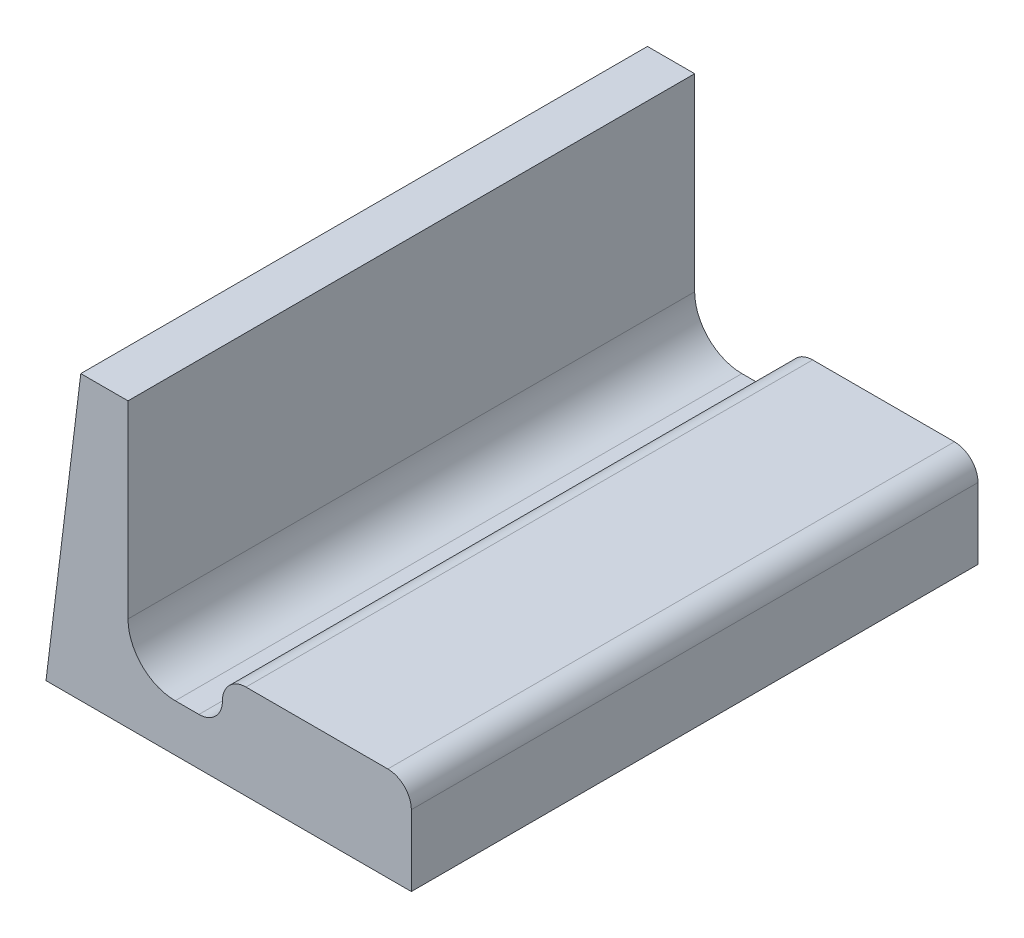
from build123d import *

# Parameters (mm, degrees)
BOSS_EXTRUDE1_DEPTH = 152.4


with BuildPart() as part:
    # Sketch1 → Boss-Extrude1 (new body)
    with BuildSketch(Plane.XY):
        with BuildLine():
            Line((0, 0), (98.256183541, 0))
            Line((98.256183541, 0), (98.256183541, 12.7))
            Line((98.256183541, 12.7), (98.256183541, 19.0754))
            ThreePointArc((98.256183541, 19.0754), (96.403751089, 23.547567548), (91.931583541, 25.4))
            Line((91.931583541, 25.4), (53.780783541, 25.4))
            ThreePointArc((53.780783541, 25.4), (49.308615993, 23.547567548), (47.456183541, 19.0754))
            Line((47.456183541, 19.0754), (47.456183541, 19.0246))
            ThreePointArc((47.456183541, 19.0246), (45.603751089, 14.552432452), (41.131583541, 12.7))
            Line((41.131583541, 12.7), (34.756183541, 12.7))
            ThreePointArc((34.756183541, 12.7), (25.77592742, 16.419743879), (22.056183541, 25.4))
            Line((22.056183541, 25.4), (22.056183541, 76.2))
            Line((22.056183541, 76.2), (9.356183541, 76.2))
            Line((9.356183541, 76.2), (0, 0))
        make_face()
    extrude(amount=BOSS_EXTRUDE1_DEPTH)


solid = part.part
